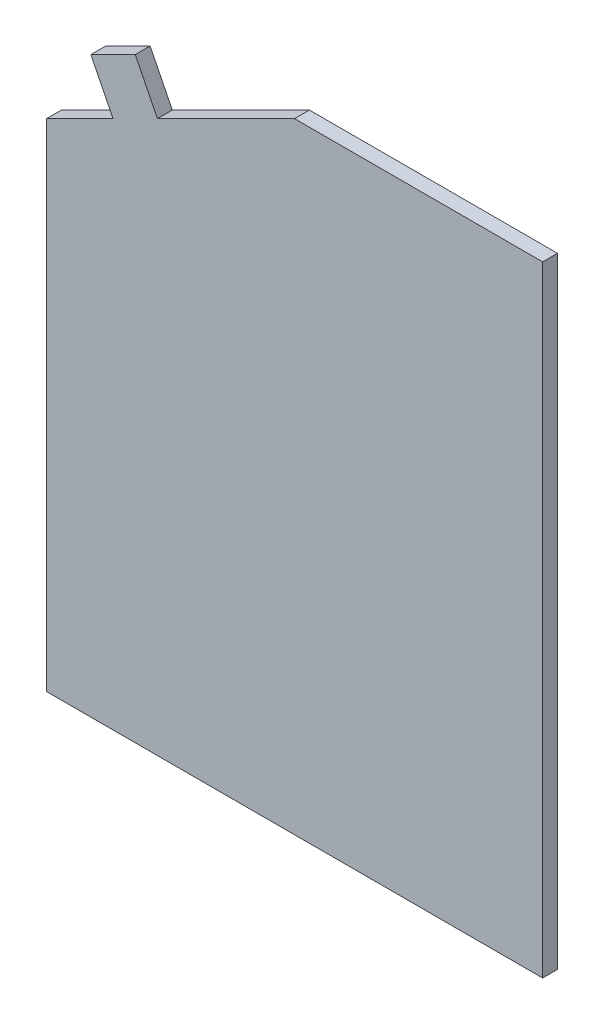
from build123d import *

# Parameters (mm, degrees)
BOSS_EXTRU_1_DEPTH = 3


with BuildPart() as part:
    # Esquisse1 → Boss.-Extru.1 (new body)
    with BuildSketch(Plane.XY):
        Polygon((0, 0), (100, 0), (100, 125), (50, 125), (22.360679775, 111.180339887), (17.88854382, 120.124611797), (8.94427191, 115.652475842), (13.416407865, 106.708203932), (0, 100), align=None)
    extrude(amount=BOSS_EXTRU_1_DEPTH)


solid = part.part
